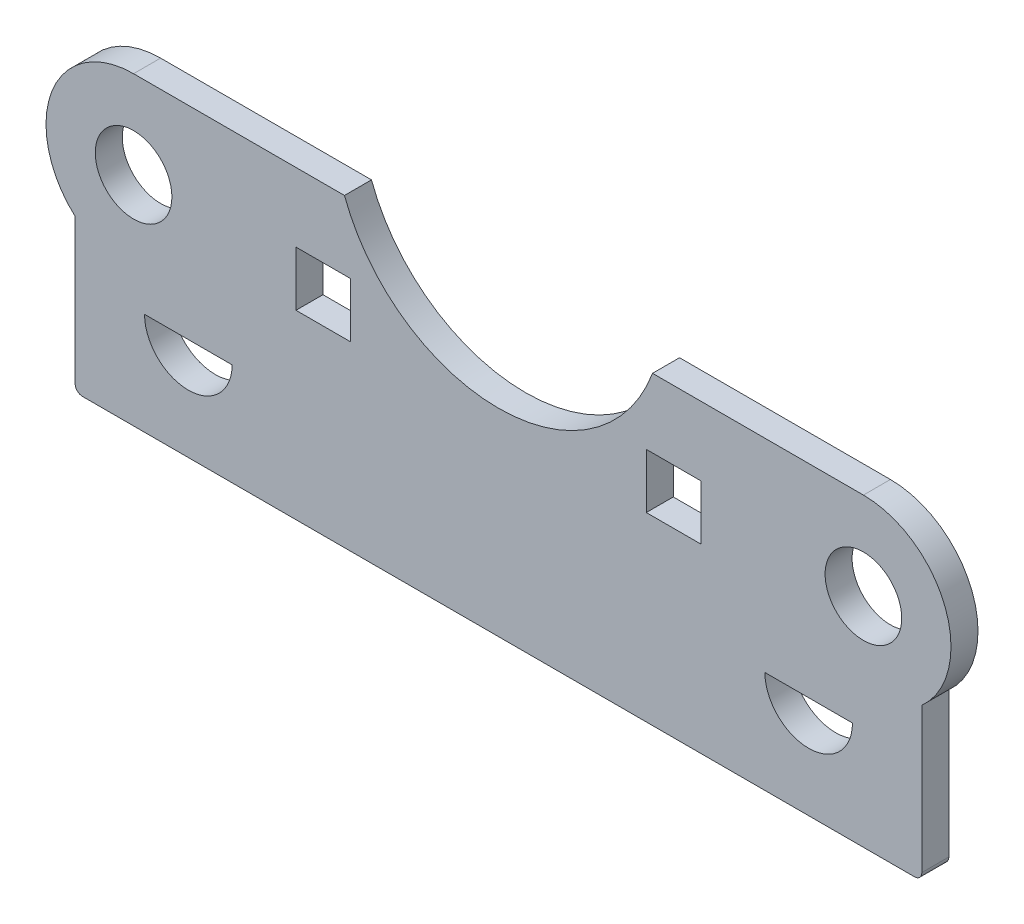
from build123d import *

# Parameters (mm, degrees)
SKETCH1_R           = 133.35
SKETCH1_W           = 190.5
SKETCH1_H           = 190.5
BOSS_EXTRUDE1_DEPTH = 93.98


with BuildPart() as part:
    # Sketch1 → Boss-Extrude1 (new body)
    with BuildSketch(Plane.XY):
        with BuildLine():
            Line((-2743.2, -227.184506514), (-2743.2, -731.52))
            ThreePointArc((-2743.2, -731.52), (-2735.760512242, -749.480512242), (-2717.8, -756.92))
            Line((-2717.8, -756.92), (-2540, -756.92))
            Line((-2540, -756.92), (177.8, -756.92))
            ThreePointArc((177.8, -756.92), (195.760512242, -749.480512242), (203.2, -731.52))
            Line((203.2, -731.52), (203.2, -227.184506514))
            ThreePointArc((203.2, -227.184506514), (284.735735012, 108.759372963), (0, 304.8))
            Line((0, 304.8), (-733.939634369, 304.8))
            ThreePointArc((-733.939634369, 304.8), (-1270, -68.58), (-1806.060365631, 304.8))
            Line((-1806.060365631, 304.8), (-2540, 304.8))
            ThreePointArc((-2540, 304.8), (-2824.735735012, 108.759372963), (-2743.2, -227.184506514))
        make_face()
        with BuildLine():
            Line((-2501.9, -401.32), (-2197.1, -401.32))
            ThreePointArc((-2197.1, -401.32), (-2349.5, -553.72), (-2501.9, -401.32))
        make_face(mode=Mode.SUBTRACT)
        with BuildLine():
            Line((-342.9, -401.32), (-38.1, -401.32))
            ThreePointArc((-38.1, -401.32), (-190.5, -553.72), (-342.9, -401.32))
        make_face(mode=Mode.SUBTRACT)
        with Locations((-2540, 0)):
            Circle(SKETCH1_R, mode=Mode.SUBTRACT)
        with Locations((-1879.6, -30.48)):
            Rectangle(SKETCH1_W, SKETCH1_H, mode=Mode.SUBTRACT)
        with Locations((-660.4, -30.48)):
            Rectangle(SKETCH1_W, SKETCH1_H, mode=Mode.SUBTRACT)
        Circle(SKETCH1_R, mode=Mode.SUBTRACT)
    extrude(amount=-BOSS_EXTRUDE1_DEPTH)


solid = part.part
